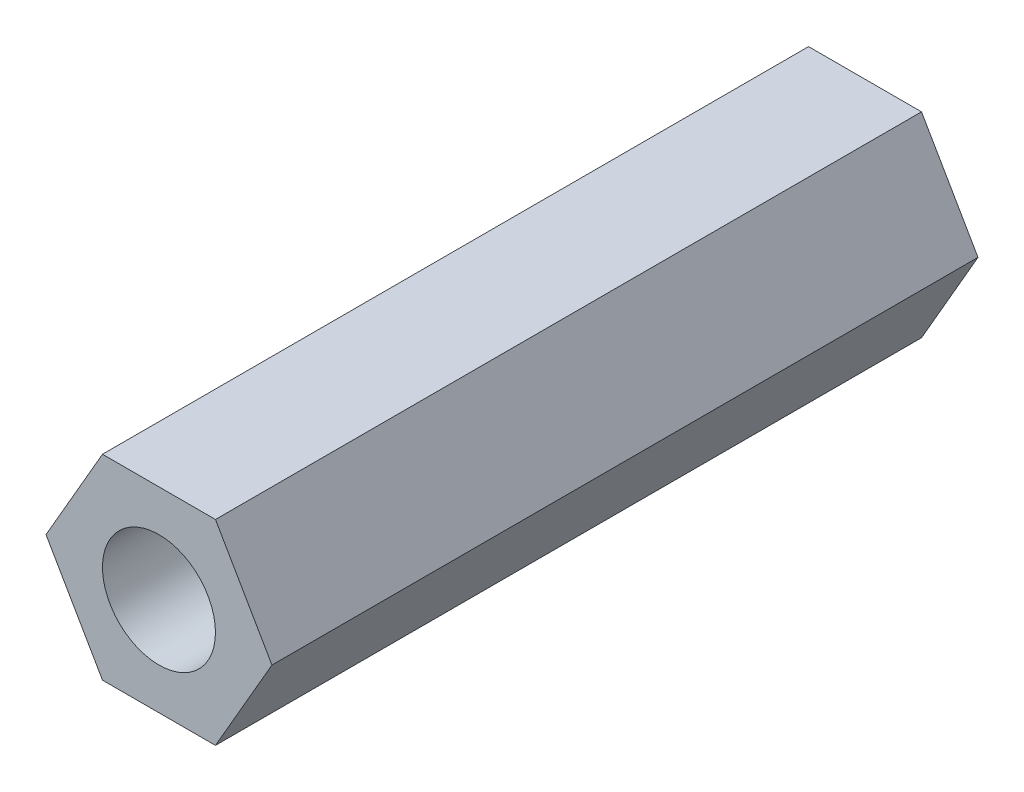
from build123d import *

# Parameters (mm, degrees)
SKETCH_1_R      = 2
EXTRUDE_1_DEPTH = 25


with BuildPart() as part:
    # 草图1 → 凸台-拉伸1 (new body)
    with BuildSketch(Plane.XY):
        Polygon((49.130607445, 79.367198797), (47.130607445, 82.831300412), (43.130607445, 82.831300412), (41.130607445, 79.367198797), (43.130607445, 75.903097182), (47.130607445, 75.903097182), align=None)
        with Locations((45.130607445, 79.367198797)):
            Circle(SKETCH_1_R, mode=Mode.SUBTRACT)
    extrude(amount=EXTRUDE_1_DEPTH)


solid = part.part
